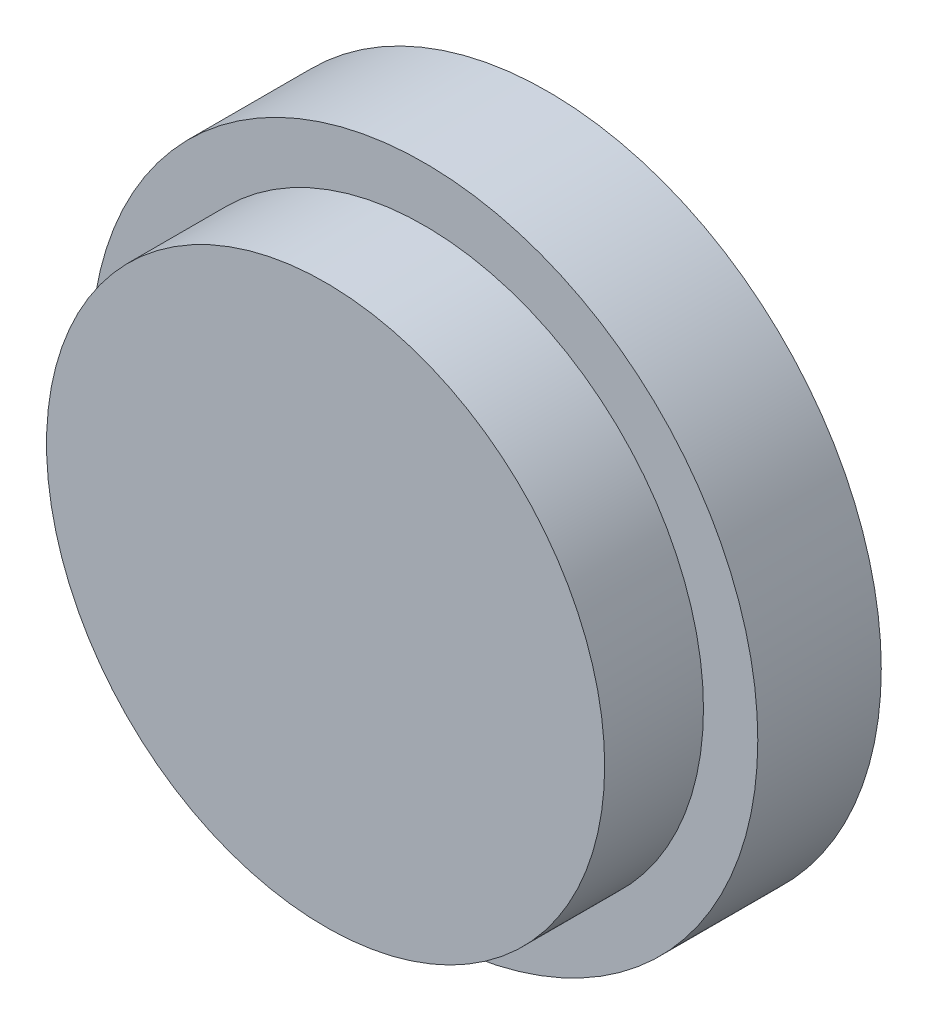
from build123d import *

# Parameters (mm, degrees)
AICAD_SKETCH_F001_R           = 13.5
AICAD_F001_BASE_EXTRUDE_DEPTH = 5
AICAD_SKETCH_F002_R           = 11.3
AICAD_F002_BOSS_EXTRUDE_DEPTH = 4


with BuildPart() as part:
    # AICAD_SKETCH_F001 → AICAD_F001_BASE_EXTRUDE (new body)
    with BuildSketch(Plane.XY):
        Circle(AICAD_SKETCH_F001_R)
    extrude(amount=AICAD_F001_BASE_EXTRUDE_DEPTH)

    # AICAD_SKETCH_F002 → AICAD_F002_BOSS_EXTRUDE (add)
    with BuildSketch(Plane.XY.offset(5)):
        Circle(AICAD_SKETCH_F002_R)
    extrude(amount=AICAD_F002_BOSS_EXTRUDE_DEPTH)


solid = part.part
